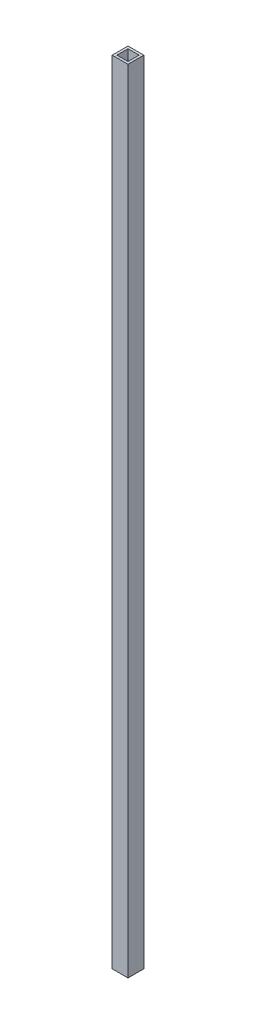
from build123d import *

# Parameters (mm, degrees)
SKETCH_1_W      = 20
SKETCH_1_H      = 20
SKETCH_1_W_2    = 14
SKETCH_1_H_2    = 14
EXTRUDE_1_DEPTH = 1000


with BuildPart() as part:
    # 草图1 → 凸台-拉伸1 (new body)
    with BuildSketch(Plane(origin=(0, 0, 0), x_dir=(1, 0, 0), z_dir=(0, 1, 0))):
        Rectangle(SKETCH_1_W, SKETCH_1_H)
        Rectangle(SKETCH_1_W_2, SKETCH_1_H_2, mode=Mode.SUBTRACT)
    extrude(amount=EXTRUDE_1_DEPTH)


solid = part.part
